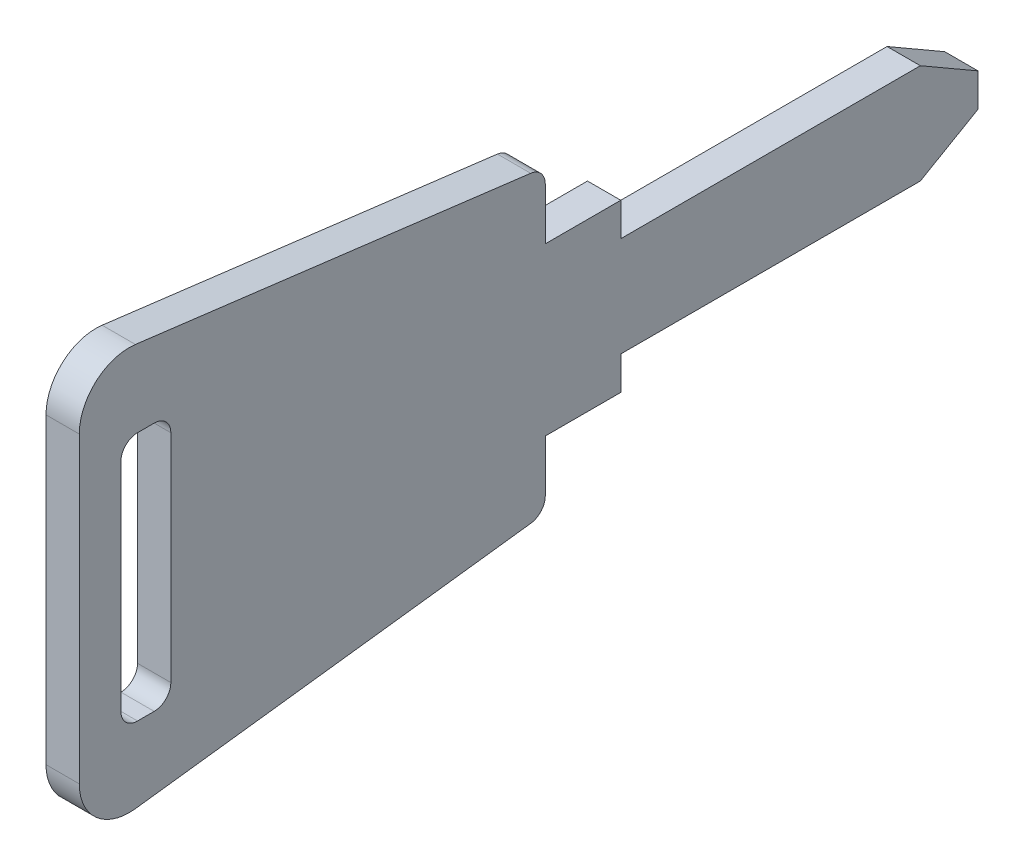
from build123d import *

# Parameters (mm, degrees)
BOSS_EXTRUDE1_DEPTH = 2
CUT_EXTRUDE1_DEPTH  = 56.375536238


with BuildPart() as part:
    # Sketch1 → Boss-Extrude1 (new body)
    with BuildSketch(Plane(origin=(0, 0, 0), x_dir=(0, 0, -1), z_dir=(1, 0, 0))):
        with BuildLine():
            Line((0, 9.101653344), (0, 0))
            Line((0, 0), (54, 0))
            Line((54, 0), (54, 1))
            Line((54, 1), (50.535898385, 3))
            Line((50.535898385, 3), (32.535898385, 3))
            Line((32.535898385, 3), (32.535898385, 5))
            Line((32.535898385, 5), (28, 5))
            Line((28, 5), (28, 8.117217781))
            ThreePointArc((28, 8.117217781), (27.749678176, 8.779020345), (27.124034735, 9.109495658))
            Line((27.124034735, 9.109495658), (3.372104204, 12.078486975))
            ThreePointArc((3.372104204, 12.078486975), (1.01459231, 11.350687872), (0, 9.101653344))
        make_face()
        with BuildLine():
            Line((0, 0), (0, -9.101653344))
            ThreePointArc((0, -9.101653344), (1.01459231, -11.350687872), (3.372104204, -12.078486975))
            Line((3.372104204, -12.078486975), (27.124034735, -9.109495658))
            ThreePointArc((27.124034735, -9.109495658), (27.749678176, -8.779020345), (28, -8.117217781))
            Line((28, -8.117217781), (28, -5))
            Line((28, -5), (32.535898385, -5))
            Line((32.535898385, -5), (32.535898385, -3))
            Line((32.535898385, -3), (50.535898385, -3))
            Line((50.535898385, -3), (54, -1))
            Line((54, -1), (54, 0))
            Line((54, 0), (0, 0))
        make_face()
    extrude(amount=BOSS_EXTRUDE1_DEPTH)

    # Sketch2 → Cut-Extrude1 (cut, through all)
    with BuildSketch(Plane(origin=(2, 0, 0), x_dir=(0, 0, -1), z_dir=(1, 0, 0))):
        with BuildLine():
            Line((4.5, -7.578486975), (3.5, -7.578486975))
            ThreePointArc((3.5, -7.578486975), (2.792893219, -7.285593756), (2.5, -6.578486975))
            Line((2.5, -6.578486975), (2.5, 6.421513025))
            ThreePointArc((2.5, 6.421513025), (2.792893219, 7.128619807), (3.5, 7.421513025))
            Line((3.5, 7.421513025), (4.5, 7.421513025))
            ThreePointArc((4.5, 7.421513025), (5.207106781, 7.128619807), (5.5, 6.421513025))
            Line((5.5, 6.421513025), (5.5, -6.578486975))
            ThreePointArc((5.5, -6.578486975), (5.207106781, -7.285593756), (4.5, -7.578486975))
        make_face()
    extrude(amount=-CUT_EXTRUDE1_DEPTH, mode=Mode.SUBTRACT)


solid = part.part
